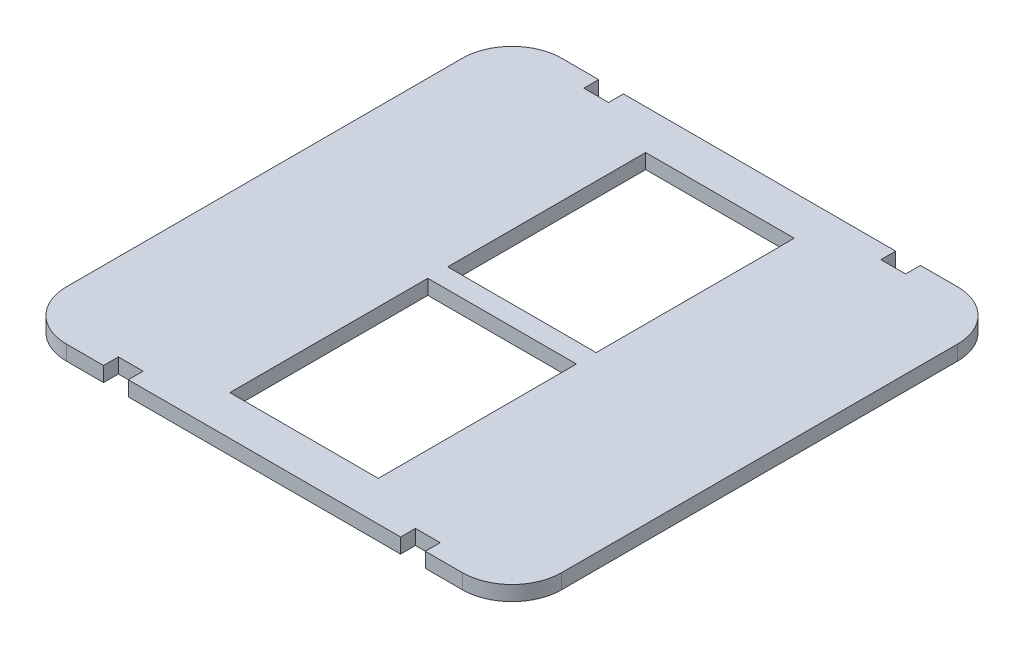
from build123d import *

# Parameters (mm, degrees)
SKETCH1_W               = 254
SKETCH1_H               = 254
PLATFORM_BASE_DEPTH     = 7.62
SKETCH7_W               = 76.2
SKETCH7_H               = 101.6
CUT_EXTRUDE4_DEPTH      = 180.766694357
CORNER_ROUNDING_R       = 25.4
SKETCH6_W               = 12.7
SKETCH6_H               = 7.62
CUT_EXTRUDE3_DEPTH      = 180.766694357
MIRROR6_COPY_1_SKETCH_W = 12.7
MIRROR6_COPY_1_SKETCH_H = 7.62
MIRROR6_COPY_1_DEPTH    = 180.766694357
MIRROR6_COPY_2_SKETCH_W = 12.7
MIRROR6_COPY_2_SKETCH_H = 7.62
MIRROR6_COPY_2_DEPTH    = 180.766694357


with BuildPart() as part:
    # Sketch1 → Platform-Base (new body)
    with BuildSketch(Plane(origin=(0, 0, 0), x_dir=(1, 0, 0), z_dir=(0, 1, 0))):
        Rectangle(SKETCH1_W, SKETCH1_H)
    extrude(amount=PLATFORM_BASE_DEPTH)

    # Sketch7 → Cut-Extrude4 (cut, through all)
    with BuildSketch(Plane(origin=(0, 7.62, 0), x_dir=(1, 0, 0), z_dir=(0, 1, 0))):
        with Locations((0, -55.88)):
            Rectangle(SKETCH7_W, SKETCH7_H)
    cut_extrude4 = extrude(amount=-CUT_EXTRUDE4_DEPTH, mode=Mode.SUBTRACT)

    # Corner-Rounding
    corner_rounding_edges = [part.edges().sort_by_distance(p)[0] for p in [
        (-127, 3.81, -127),
        (127, 3.81, -127),
        (127, 3.81, 127),
        (-127, 3.81, 127),
    ]]
    fillet(corner_rounding_edges, radius=CORNER_ROUNDING_R)

    # Sketch6 → Cut-Extrude3 (cut, through all)
    with BuildSketch(Plane(origin=(0, 7.62, 0), x_dir=(1, 0, 0), z_dir=(0, 1, 0))):
        with Locations((-76.2, -123.19)):
            Rectangle(SKETCH6_W, SKETCH6_H)
    cut_extrude3 = extrude(amount=-CUT_EXTRUDE3_DEPTH, mode=Mode.SUBTRACT)

    # Mirror4: Cut-Extrude3 across plane
    add(cut_extrude3.mirror(Plane.XY), mode=Mode.SUBTRACT)

    # Mirror5: Cut-Extrude4 across plane
    add(cut_extrude4.mirror(Plane.XY), mode=Mode.SUBTRACT)

    # Mirror6 copy 1 sketch → Mirror6 copy 1 (cut, through all)
    with BuildSketch(Plane(origin=(0, 7.62, 0), x_dir=(-1, 0, 0), z_dir=(0, 1, 0))):
        with Locations((-76.2, -123.19)):
            Rectangle(MIRROR6_COPY_1_SKETCH_W, MIRROR6_COPY_1_SKETCH_H)
    extrude(amount=-MIRROR6_COPY_1_DEPTH, mode=Mode.SUBTRACT)

    # Mirror6 copy 2 sketch → Mirror6 copy 2 (cut, through all)
    with BuildSketch(Plane(origin=(0, 7.62, 0), x_dir=(-1, 0, 0), z_dir=(0, 1, 0))):
        with Locations((-76.2, 123.19)):
            Rectangle(MIRROR6_COPY_2_SKETCH_W, MIRROR6_COPY_2_SKETCH_H)
    extrude(amount=-MIRROR6_COPY_2_DEPTH, mode=Mode.SUBTRACT)


solid = part.part
